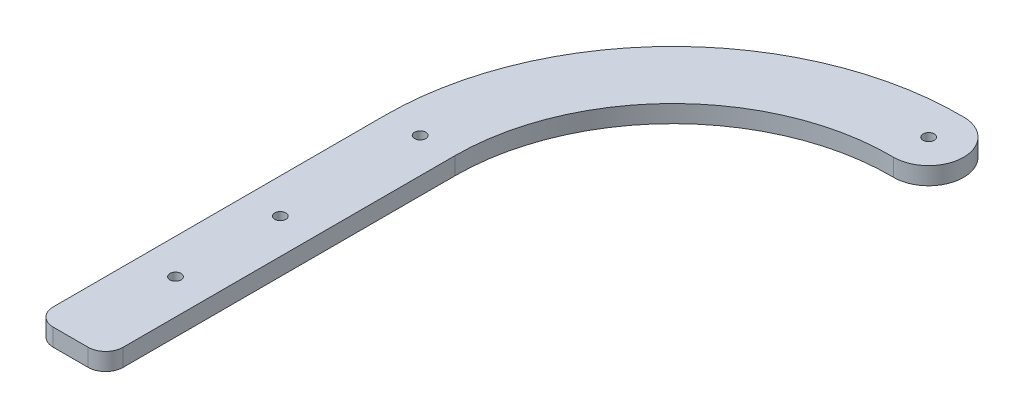
from build123d import *

# Parameters (mm, degrees)
EXTRUDE_1_DEPTH     = 5
SKETCH_2_R          = 1.6
CUT_EXTRUDE_2_DEPTH = 205.826540078
FILLET_1_R          = 5


with BuildPart() as part:
    # 草圖1 → 伸長1 (new body)
    with BuildSketch(Plane(origin=(0, 0, 0), x_dir=(1, 0, 0), z_dir=(0, 1, 0))):
        with BuildLine():
            Line((0, 50), (0, 100))
            ThreePointArc((0, 100), (24.455049934, 158.55833165), (83.293389788, 182.331792401))
            ThreePointArc((83.293389788, 182.331792401), (93.176602271, 172.216353161), (83.061163031, 162.333140678))
            ThreePointArc((83.061163031, 162.333140678), (38.514841271, 144.334328431), (20, 100))
            Line((20, 100), (20, 50))
            Line((20, 50), (20, 0))
            Line((20, 0), (0, 0))
            Line((0, 0), (0, 50))
        make_face()
    extrude(amount=EXTRUDE_1_DEPTH)

    # 草圖2 → 伸長2 (cut, through all)
    with BuildSketch(Plane(origin=(0, 5, 0), x_dir=(1, 0, 0), z_dir=(0, 1, 0))):
        with Locations(Location((10, 60, 0), (0, 0, 270))):
            Circle(SKETCH_2_R)
        with Locations(Location((10, 30, 0), (0, 0, 270))):
            Circle(SKETCH_2_R)
        with Locations(Location((83.177276409, 172.33246654, 0), (0, 0, 270))):
            Circle(SKETCH_2_R)
        with Locations(Location((10, 100, 0), (0, 0, 270))):
            Circle(SKETCH_2_R)
    extrude(amount=-CUT_EXTRUDE_2_DEPTH, mode=Mode.SUBTRACT)

    # 圓角1
    fillet_1_edges = [part.edges().sort_by_distance(p)[0] for p in [
        (20, 2.5, 0),
        (0, 2.5, 0),
    ]]
    fillet(fillet_1_edges, radius=FILLET_1_R)


solid = part.part
